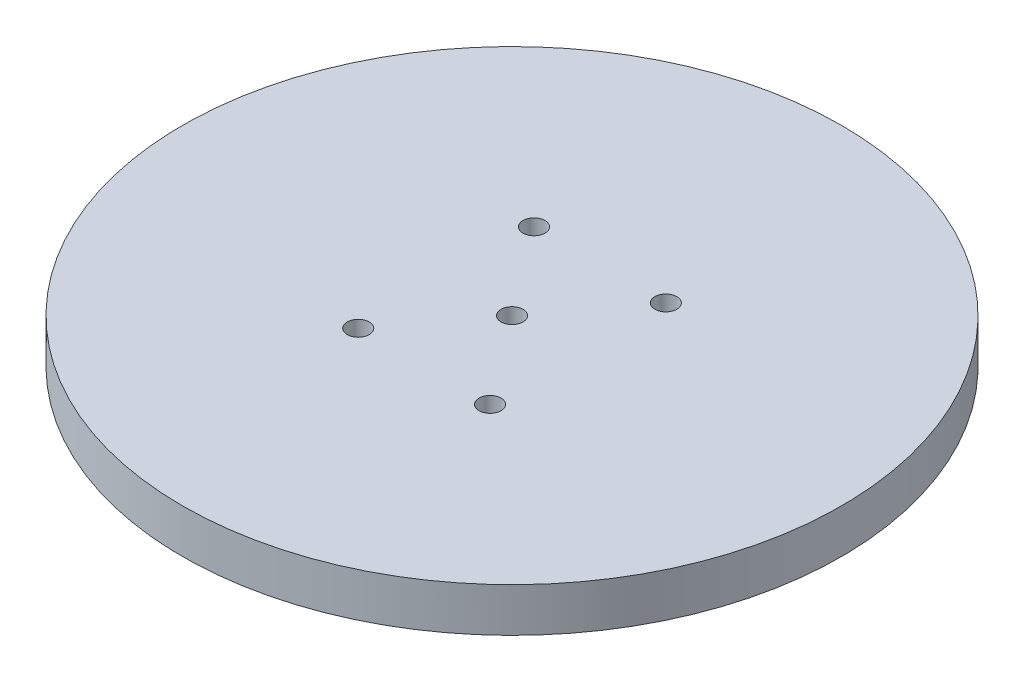
from build123d import *

# Parameters (mm, degrees)
SKETCH1_R           = 75
BOSS_EXTRUDE1_DEPTH = 30
SKETCH2_R           = 75
SKETCH2_R_2         = 7.5
CUT_EXTRUDE1_DEPTH  = 20
SKETCH3_R           = 2.5
CUT_EXTRUDE2_DEPTH  = 30
SKETCH4_R           = 2.5
CUT_EXTRUDE3_DEPTH  = 10


with BuildPart() as part:
    # Sketch1 → Boss-Extrude1 (new body)
    with BuildSketch(Plane(origin=(0, 0, 0), x_dir=(1, 0, 0), z_dir=(0, 1, 0))):
        with Locations(Location((0, 0, 0), (0, 0, 270))):
            Circle(SKETCH1_R)
    extrude(amount=BOSS_EXTRUDE1_DEPTH)

    # Sketch2 → Cut-Extrude1 (cut)
    with BuildSketch(Plane.XZ):
        with Locations(Location((0, 0, 0), (0, 0, 270))):
            Circle(SKETCH2_R)
        with Locations(Location((0, 0, 0), (0, 0, 270))):
            Circle(SKETCH2_R_2, mode=Mode.SUBTRACT)
    extrude(amount=-CUT_EXTRUDE1_DEPTH, mode=Mode.SUBTRACT)

    # Sketch3 → Cut-Extrude2 (cut)
    with BuildSketch(Plane(origin=(0, 30, 0), x_dir=(1, 0, 0), z_dir=(0, 1, 0))):
        with Locations(Location((0, 0, 0), (0, 0, 270))):
            Circle(SKETCH3_R)
    extrude(amount=-CUT_EXTRUDE2_DEPTH, mode=Mode.SUBTRACT)

    # Sketch4 → Cut-Extrude3 (cut)
    with BuildSketch(Plane(origin=(0, 30, 0), x_dir=(1, 0, 0), z_dir=(0, 1, 0))):
        with Locations(Location((-15, 20, 0), (0, 0, 270))):
            Circle(SKETCH4_R)
        with Locations(Location((15, 20, 0), (0, 0, 270))):
            Circle(SKETCH4_R)
        with Locations(Location((-15, -20, 0), (0, 0, 270))):
            Circle(SKETCH4_R)
        with Locations(Location((15, -20, 0), (0, 0, 270))):
            Circle(SKETCH4_R)
    extrude(amount=-CUT_EXTRUDE3_DEPTH, mode=Mode.SUBTRACT)


solid = part.part
